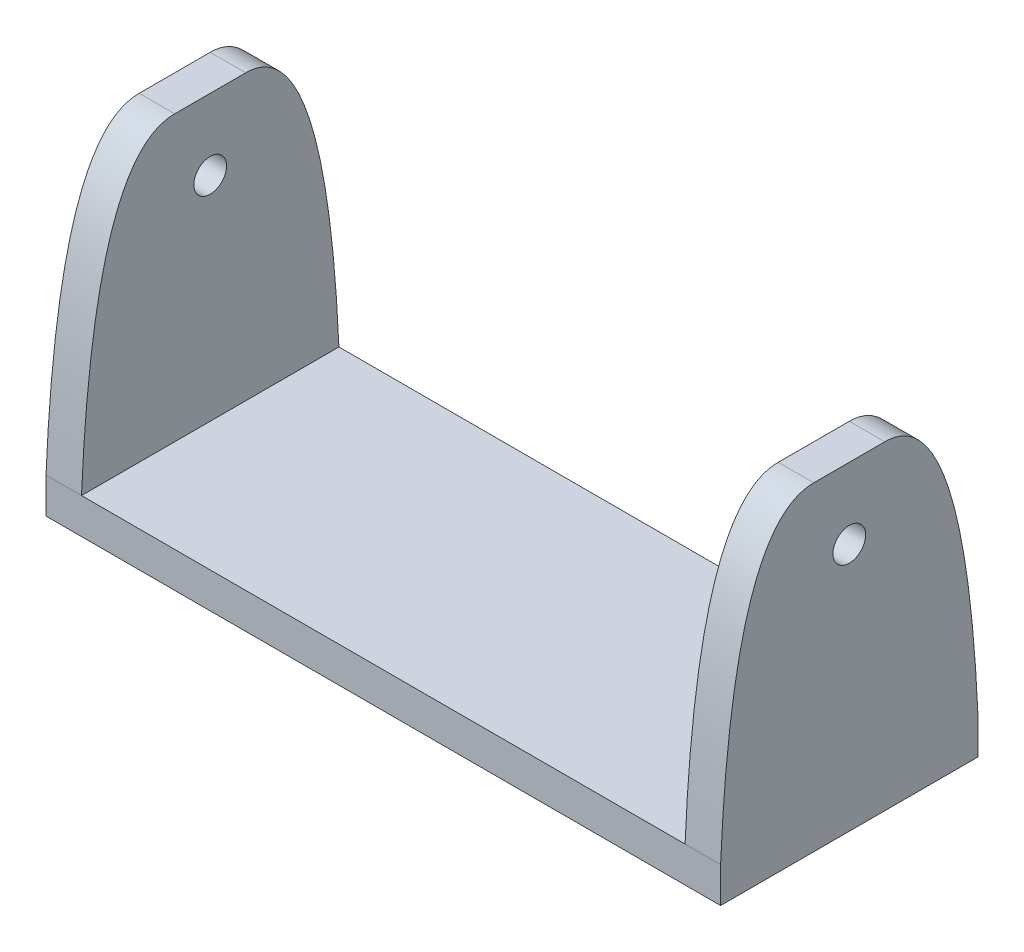
from build123d import *

# Parameters (mm, degrees)
SKETCH1_W               = 76
SKETCH1_H               = 29
BOSS_EXTRUDE1_DEPTH     = 4
SKETCH2_W               = 4
SKETCH2_H               = 29
BOSS_EXTRUDE2_DEPTH     = 32
CUT_EXTRUDE1_REACH      = 87.336
CUT_EXTRUDE2_DEPTH      = 82.793948581
CUT_EXTRUDE2_DEPTH_BACK = 82.793948581
SKETCH4_R               = 1.843066456


with BuildPart() as part:
    # Sketch1 → Boss-Extrude1 (new body)
    with BuildSketch(Plane(origin=(0, 0, 0), x_dir=(1, 0, 0), z_dir=(0, 1, 0))):
        Rectangle(SKETCH1_W, SKETCH1_H)
    extrude(amount=BOSS_EXTRUDE1_DEPTH)

    # Sketch2 → Boss-Extrude2 (add)
    with BuildSketch(Plane(origin=(0, 4, 0), x_dir=(1, 0, 0), z_dir=(0, 1, 0))):
        with Locations((-36, 0)):
            Rectangle(SKETCH2_W, SKETCH2_H)
        with Locations((36, 0)):
            Rectangle(SKETCH2_W, SKETCH2_H)
    extrude(amount=BOSS_EXTRUDE2_DEPTH)

    # Cut-Extrude1: up to this face of the body (flat: up to its plane)
    cut_extrude1_end = Plane(part.part.faces().sort_by_distance((38, 18, 0))[0])
    # Sketch3 → Cut-Extrude1 (cut, up to the picked face)
    with BuildSketch(Plane.ZY.offset(38), mode=Mode.PRIVATE) as cut_extrude1_sk1:
        with BuildLine():
            Line((14.5, 4), (14.5, 36))
            Line((14.5, 36), (4, 36))
            add(Edge.make_bspline(
                [(14.5, 4), (13.053007325, 36), (4, 36)],
                knots=[0, 0, 0, 1, 1, 1], degree=2))
        make_face()
    cut_extrude1_tool1 = split(extrude(cut_extrude1_sk1.sketch, amount=-CUT_EXTRUDE1_REACH, mode=Mode.PRIVATE), bisect_by=cut_extrude1_end, keep=Keep.BOTH, mode=Mode.PRIVATE)
    # Sketch3 → Cut-Extrude1 (cut, up to the picked face)
    with BuildSketch(Plane.ZY.offset(38), mode=Mode.PRIVATE) as cut_extrude1_sk2:
        with BuildLine():
            Line((-4, 36), (-14.5, 36))
            Line((-14.5, 36), (-14.5, 4))
            add(Edge.make_bspline(
                [(-14.5, 4), (-13.053007325, 36), (-4, 36)],
                knots=[0, 0, 0, 1, 1, 1], degree=2))
        make_face()
    cut_extrude1_tool2 = split(extrude(cut_extrude1_sk2.sketch, amount=-CUT_EXTRUDE1_REACH, mode=Mode.PRIVATE), bisect_by=cut_extrude1_end, keep=Keep.BOTH, mode=Mode.PRIVATE)
    add(cut_extrude1_tool1.solids().sort_by(Axis((-38, 28.217177, 12.337471), (1, 0, 0)))[0], mode=Mode.SUBTRACT)
    add(cut_extrude1_tool2.solids().sort_by(Axis((-38, 28.217177, -12.337471), (1, 0, 0)))[0], mode=Mode.SUBTRACT)

    # Sketch4 → Cut-Extrude2 (cut, two sides: drawn at the far end of the back side and taken through both)
    with BuildSketch(Plane.ZY.offset(-34).offset(-CUT_EXTRUDE2_DEPTH_BACK)):
        with Locations((0, 28)):
            Circle(SKETCH4_R)
    extrude(amount=CUT_EXTRUDE2_DEPTH + CUT_EXTRUDE2_DEPTH_BACK, mode=Mode.SUBTRACT)


solid = part.part
